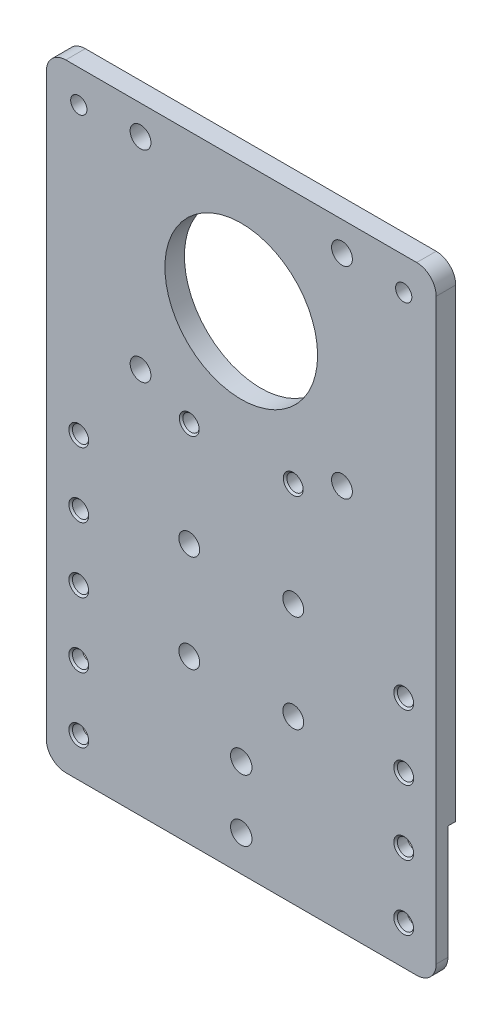
from build123d import *

# Parameters (mm, degrees)
SKETCH_1_R           = 11.75
SKETCH_1_R_2         = 1.6
EXTRUDE_1_DEPTH      = 3
M3X0_5_4_D           = 2.5
M3X0_5_4_CSINK_D     = 3.05
M3X0_5_4_CSINK_ANGLE = 90
M4X0_7_1_D           = 3.3
M4X0_7_1_CSINK_D     = 4.05
M4X0_7_1_CSINK_ANGLE = 90
M3X0_5_5_D           = 2.5
M3X0_5_5_CSINK_D     = 3.05
M3X0_5_5_CSINK_ANGLE = 90
SKETCH_23_W          = 9.6
SKETCH_23_H          = 20.5
SKETCH_23_W_2        = 2.4
SKETCH_23_W_3        = 4
CUT_EXTRUDE_4_DEPTH  = 1.2
FILLET_1_R           = 0.6


with BuildPart() as part:
    # 草图1 → 凸台-拉伸1 (new body)
    with BuildSketch(Plane.XY):
        with BuildLine():
            Line((-30, -25), (-30, -67))
            ThreePointArc((-30, -67), (-29.121320344, -69.121320344), (-27, -70))
            Line((-27, -70), (27, -70))
            ThreePointArc((27, -70), (29.121320344, -69.121320344), (30, -67))
            Line((30, -67), (30, 22))
            ThreePointArc((30, 22), (29.121320344, 24.121320344), (27, 25))
            Line((27, 25), (-27, 25))
            ThreePointArc((-27, 25), (-29.121320344, 24.121320344), (-30, 22))
            Line((-30, 22), (-30, -25))
        make_face()
        with Locations((0, 5)):
            Circle(SKETCH_1_R, mode=Mode.SUBTRACT)
        with Locations((15.5, 20.5)):
            Circle(SKETCH_1_R_2, mode=Mode.SUBTRACT)
        with Locations((-15.5, 20.5)):
            Circle(SKETCH_1_R_2, mode=Mode.SUBTRACT)
        with Locations((-15.5, -10.5)):
            Circle(SKETCH_1_R_2, mode=Mode.SUBTRACT)
        with Locations((15.5, -10.5)):
            Circle(SKETCH_1_R_2, mode=Mode.SUBTRACT)
        with Locations((-8, -30)):
            Circle(SKETCH_1_R_2, mode=Mode.SUBTRACT)
        with Locations((8, -30)):
            Circle(SKETCH_1_R_2, mode=Mode.SUBTRACT)
        with Locations((-8, -45)):
            Circle(SKETCH_1_R_2, mode=Mode.SUBTRACT)
        with Locations((8, -45)):
            Circle(SKETCH_1_R_2, mode=Mode.SUBTRACT)
    extrude(amount=EXTRUDE_1_DEPTH)

    # M3x0.5 螺纹孔4 (through all)
    with Locations(Plane.XY.offset(3)):
        with Locations((-25, -44), (-25, -54), (25, -44), (25, -54), (25, -64), (-25, -64), (-8, -14), (8, -14), (25, -34), (-25, -34), (-25, -24)):
            CounterSinkHole(M3X0_5_4_D / 2, M3X0_5_4_CSINK_D / 2, counter_sink_angle=M3X0_5_4_CSINK_ANGLE)

    # M4x0.7 螺纹孔1 (through all)
    with Locations(Plane(origin=(0, 0, 0), x_dir=(-1, 0, 0), z_dir=(0, 0, -1))):
        with Locations((0, -55), (0, -64.5)):
            CounterSinkHole(M4X0_7_1_D / 2, M4X0_7_1_CSINK_D / 2, counter_sink_angle=M4X0_7_1_CSINK_ANGLE)

    # M3x0.5 螺纹孔5 (through all)
    with Locations(Plane(origin=(0, 0, 0), x_dir=(-1, 0, 0), z_dir=(0, 0, -1))):
        with Locations((-25, 20), (25, 20)):
            CounterSinkHole(M3X0_5_5_D / 2, M3X0_5_5_CSINK_D / 2, counter_sink_angle=M3X0_5_5_CSINK_ANGLE)

    # 草图23 → 切除-拉伸4 (cut)
    with BuildSketch(Plane(origin=(0, 0, 0), x_dir=(-1, 0, 0), z_dir=(0, 0, -1))):
        with Locations((-25.2, -59.75)):
            Rectangle(SKETCH_23_W, SKETCH_23_H)
        with Locations((25.2, -59.75)):
            Rectangle(SKETCH_23_W, SKETCH_23_H)
        with Locations((-18.4, -59.75)):
            Rectangle(SKETCH_23_W_2, SKETCH_23_H)
        with Locations((-15.2, -59.75)):
            Rectangle(SKETCH_23_W_2, SKETCH_23_H)
        with Locations((-12, -59.75)):
            Rectangle(SKETCH_23_W_2, SKETCH_23_H)
        with Locations((-8, -59.75)):
            Rectangle(SKETCH_23_W_3, SKETCH_23_H)
        with Locations((12, -59.75)):
            Rectangle(SKETCH_23_W_2, SKETCH_23_H)
        with Locations((8, -59.75)):
            Rectangle(SKETCH_23_W_3, SKETCH_23_H)
        with Locations((15.2, -59.75)):
            Rectangle(SKETCH_23_W_2, SKETCH_23_H)
        with Locations((18.4, -59.75)):
            Rectangle(SKETCH_23_W_2, SKETCH_23_H)
    extrude(amount=-CUT_EXTRUDE_4_DEPTH, mode=Mode.SUBTRACT)

    # 圆角1
    fillet_1_edges = [part.edges().sort_by_distance(p)[0] for p in [
        (20.4, -49.5, 0.6),
        (-17.2, -49.5, 0.6),
        (-19.6, -49.5, 0.6),
        (13.2, -49.5, 0.6),
        (10.8, -49.5, 0.6),
        (16.4, -49.5, 0.6),
        (14, -49.5, 0.6),
        (19.6, -49.5, 0.6),
        (17.2, -49.5, 0.6),
        (-20.4, -49.5, 0.6),
        (-14, -49.5, 0.6),
        (-16.4, -49.5, 0.6),
        (-6, -49.5, 0.6),
        (-10, -49.5, 0.6),
        (-10.8, -49.5, 0.6),
        (-13.2, -49.5, 0.6),
        (10, -49.5, 0.6),
        (6, -49.5, 0.6),
    ]]
    fillet(fillet_1_edges, radius=FILLET_1_R)


solid = part.part
